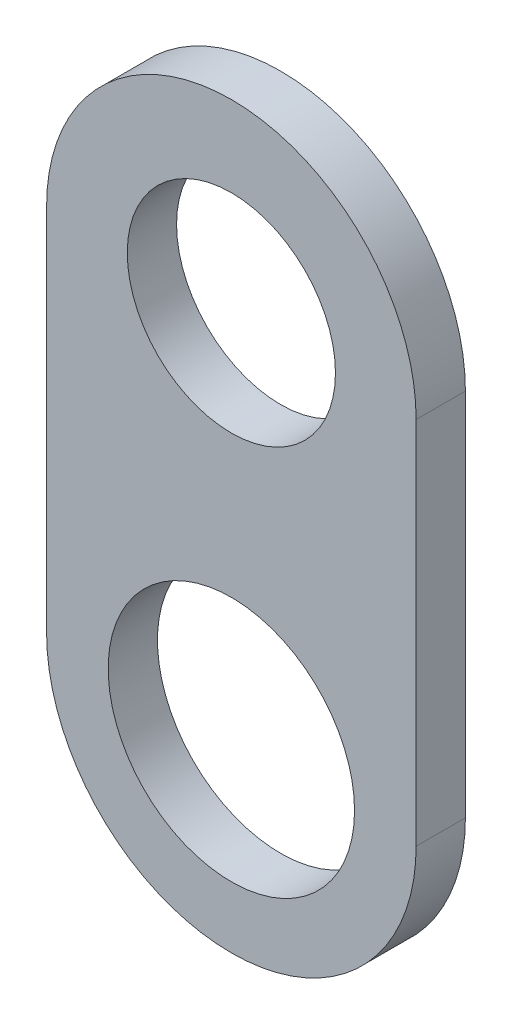
from build123d import *

# Parameters (mm, degrees)
SKETCH1_R           = 10.7315
SKETCH1_R_2         = 12.7
BOSS_EXTRUDE1_DEPTH = 5.08


with BuildPart() as part:
    # Sketch1 → Boss-Extrude1 (new body)
    with BuildSketch(Plane.XY):
        with BuildLine():
            Line((-19.05, -38.1), (-19.05, 0))
            ThreePointArc((-19.05, 0), (0, 19.05), (19.05, 0))
            Line((19.05, 0), (19.05, -38.1))
            ThreePointArc((19.05, -38.1), (0, -57.15), (-19.05, -38.1))
        make_face()
        Circle(SKETCH1_R, mode=Mode.SUBTRACT)
        with Locations((0, -38.1)):
            Circle(SKETCH1_R_2, mode=Mode.SUBTRACT)
    extrude(amount=BOSS_EXTRUDE1_DEPTH)


solid = part.part
